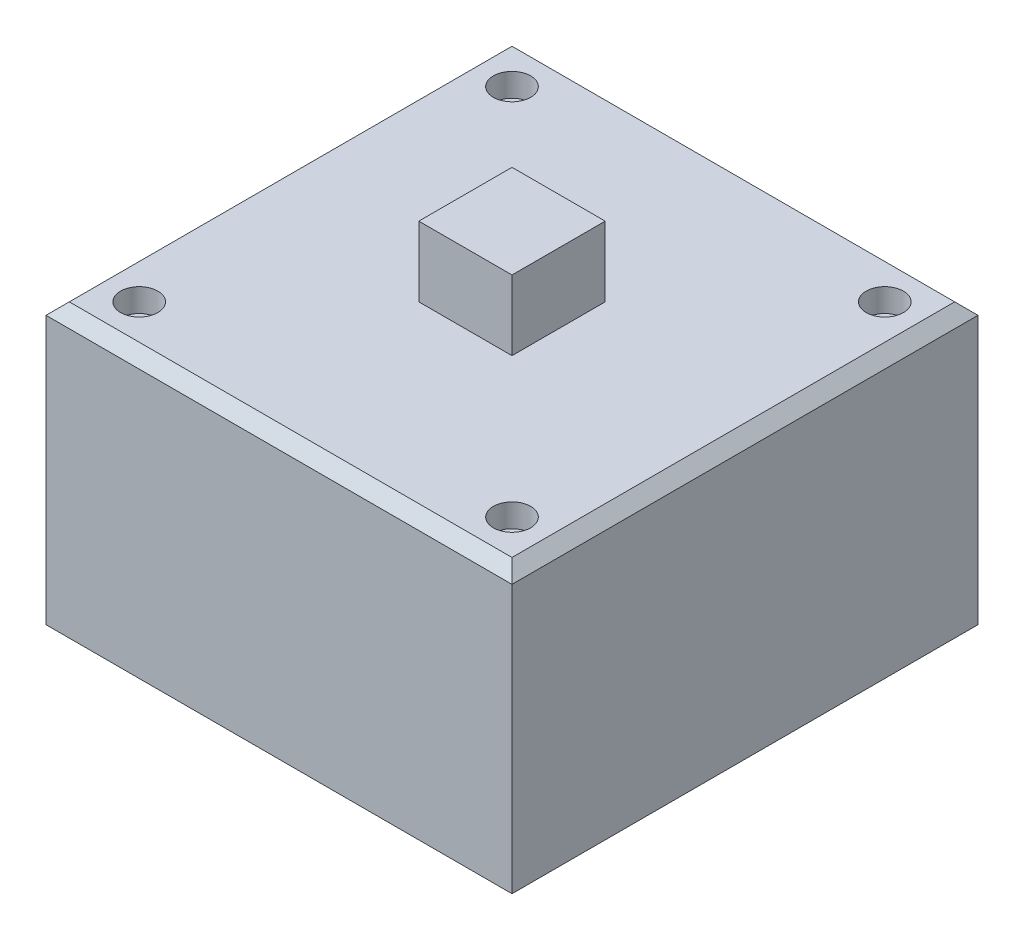
from build123d import *

# Parameters (mm, degrees)
SKETCH1_W           = 50.8
SKETCH1_H           = 50.8
BOSS_EXTRUDE1_DEPTH = 38.1
SKETCH2_W           = 50.8
SKETCH2_H           = 50.8
SKETCH2_W_2         = 10.16
SKETCH2_H_2         = 10.16
CUT_EXTRUDE1_DEPTH  = 7.62
SKETCH3_R           = 2.032
SKETCH3_R_2         = 1.524
CUT_EXTRUDE2_DEPTH  = 2.54
SKETCH4_R           = 1.524
CUT_EXTRUDE3_DEPTH  = 20.32
CHAMFER2_SIZE       = 1.27


with BuildPart() as part:
    # Sketch1 → Boss-Extrude1 (new body)
    with BuildSketch(Plane(origin=(0, 0, 0), x_dir=(1, 0, 0), z_dir=(0, 1, 0))):
        Rectangle(SKETCH1_W, SKETCH1_H)
    extrude(amount=BOSS_EXTRUDE1_DEPTH)

    # Sketch2 → Cut-Extrude1 (cut)
    with BuildSketch(Plane(origin=(0, 38.1, 0), x_dir=(1, 0, 0), z_dir=(0, 1, 0))):
        Rectangle(SKETCH2_W, SKETCH2_H)
        Rectangle(SKETCH2_W_2, SKETCH2_H_2, mode=Mode.SUBTRACT)
    extrude(amount=-CUT_EXTRUDE1_DEPTH, mode=Mode.SUBTRACT)

    # Sketch3 → Cut-Extrude2 (cut)
    # profile 1 of 4: a face of its own
    with BuildSketch(Plane(origin=(0, 30.48, 0), x_dir=(1, 0, 0), z_dir=(0, 1, 0))):
        with Locations(Location((-20.32, -20.32, 0), (0, 0, 270))):
            Circle(SKETCH3_R)
        with Locations(Location((-20.32, -20.32, 0), (0, 0, 270))):
            Circle(SKETCH3_R_2, mode=Mode.SUBTRACT)
    # profile 2 of 4: a face of its own
    with BuildSketch(Plane(origin=(0, 30.48, 0), x_dir=(1, 0, 0), z_dir=(0, 1, 0))):
        with Locations(Location((-20.32, 20.32, 0), (0, 0, 270))):
            Circle(SKETCH3_R)
        with Locations(Location((-20.32, 20.32, 0), (0, 0, 270))):
            Circle(SKETCH3_R_2, mode=Mode.SUBTRACT)
    # profile 3 of 4: a face of its own
    with BuildSketch(Plane(origin=(0, 30.48, 0), x_dir=(1, 0, 0), z_dir=(0, 1, 0))):
        with Locations(Location((20.32, 20.32, 0), (0, 0, 270))):
            Circle(SKETCH3_R)
        with Locations(Location((20.32, 20.32, 0), (0, 0, 270))):
            Circle(SKETCH3_R_2, mode=Mode.SUBTRACT)
    # profile 4 of 4: a face of its own
    with BuildSketch(Plane(origin=(0, 30.48, 0), x_dir=(1, 0, 0), z_dir=(0, 1, 0))):
        with Locations(Location((20.32, -20.32, 0), (0, 0, 270))):
            Circle(SKETCH3_R)
        with Locations(Location((20.32, -20.32, 0), (0, 0, 270))):
            Circle(SKETCH3_R_2, mode=Mode.SUBTRACT)
    extrude(amount=-CUT_EXTRUDE2_DEPTH, mode=Mode.SUBTRACT)

    # Sketch4 → Cut-Extrude3 (cut)
    with BuildSketch(Plane(origin=(0, 30.48, 0), x_dir=(1, 0, 0), z_dir=(0, 1, 0))):
        with Locations(Location((-20.32, -20.32, 0), (0, 0, 270))):
            Circle(SKETCH4_R)
        with Locations(Location((-20.32, 20.32, 0), (0, 0, 270))):
            Circle(SKETCH4_R)
        with Locations(Location((20.32, 20.32, 0), (0, 0, 270))):
            Circle(SKETCH4_R)
        with Locations(Location((20.32, -20.32, 0), (0, 0, 270))):
            Circle(SKETCH4_R)
    extrude(amount=-CUT_EXTRUDE3_DEPTH, mode=Mode.SUBTRACT)

    # Chamfer2
    chamfer2_edges = [part.edges().sort_by_distance(p)[0] for p in [
        (25.4, 30.48, 0),
        (0, 30.48, 25.4),
        (-25.4, 30.48, 0),
        (0, 30.48, -25.4),
    ]]
    chamfer(chamfer2_edges, length=CHAMFER2_SIZE)


solid = part.part
